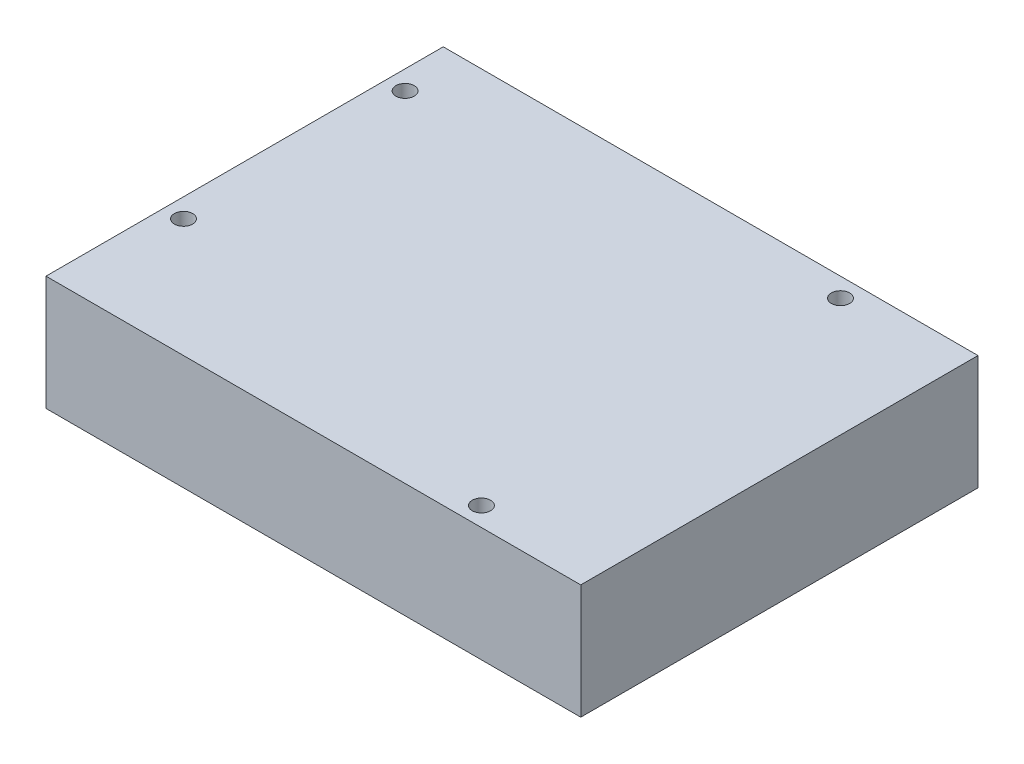
from build123d import *

# Parameters (mm, degrees)
SCHIZZO2_W                   = 70
SCHIZZO2_H                   = 52
ESTRUSIONE_ESTRUSIONE1_DEPTH = 15
FORO_PER_VITE_M2_1_D         = 2.4


with BuildPart() as part:
    # Schizzo2 → Estrusione-Estrusione1 (new body)
    with BuildSketch(Plane(origin=(0, 0, 0), x_dir=(1, 0, 0), z_dir=(0, 1, 0))):
        Rectangle(SCHIZZO2_W, SCHIZZO2_H)
    extrude(amount=ESTRUSIONE_ESTRUSIONE1_DEPTH)

    # Foro per Vite M2-1 (through all)
    with Locations(Plane(origin=(0, 15, 0), x_dir=(1, 0, 0), z_dir=(0, 1, 0))):
        with Locations((19.5, -23.5), (19.5, 23.5), (-32.5, 18.5), (-32.5, -10.5)):
            Hole(FORO_PER_VITE_M2_1_D / 2)


solid = part.part
